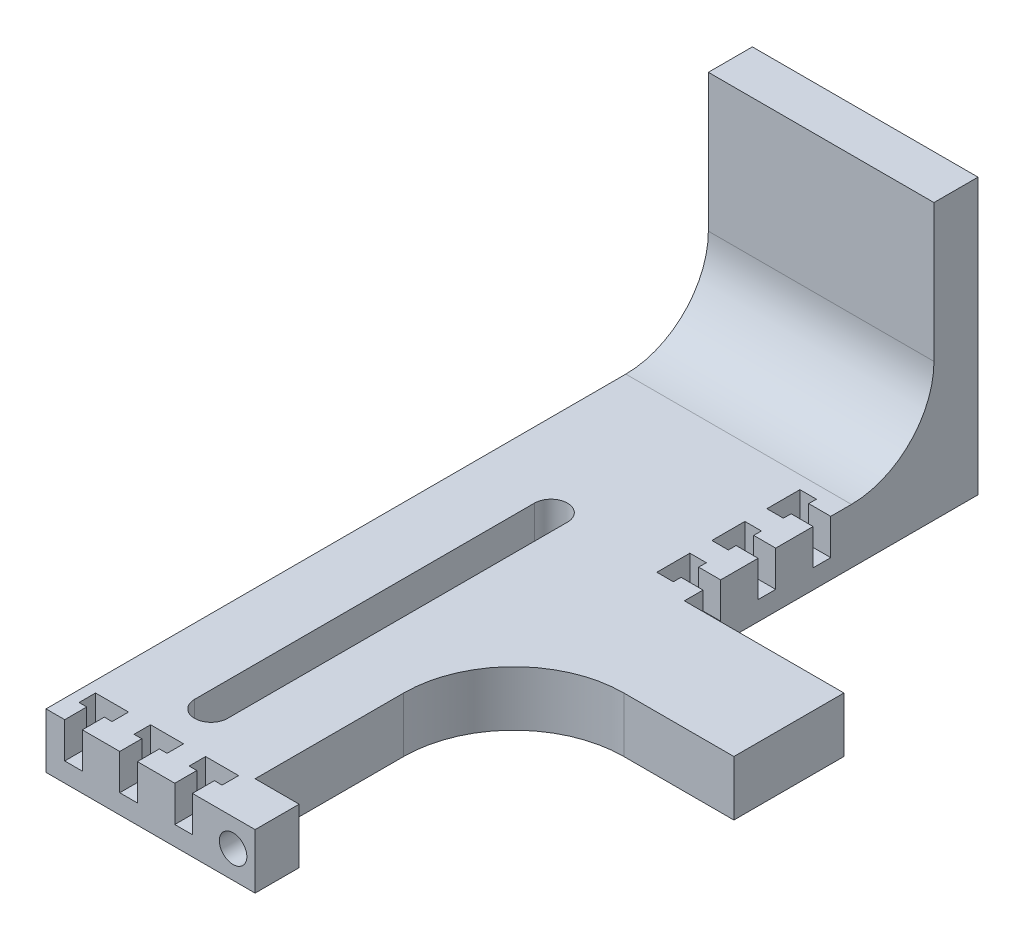
from build123d import *

# Parameters (mm, degrees)
EXTRUDE_1_DEPTH     = 10
CUT_EXTRUDE_3_DEPTH = 16
SKETCH_6_W          = 4
SKETCH_6_H          = 3.2
SKETCH_6_W_2        = 3.2
SKETCH_6_H_2        = 4
CUT_EXTRUDE_5_DEPTH = 6.5
SKETCH_7_W          = 6
SKETCH_7_H          = 3
SKETCH_7_W_2        = 3
SKETCH_7_H_2        = 6
CUT_EXTRUDE_6_DEPTH = 16.5
SKETCH_8_W          = 40
SKETCH_8_H          = 20
EXTRUDE_2_DEPTH     = 10
SKETCH_9_W          = 41
SKETCH_9_H          = 10
EXTRUDE_3_DEPTH     = 23.36
SKETCH_10_W         = 41
SKETCH_10_H         = 8
EXTRUDE_4_DEPTH     = 40
SKETCH_11_W         = 8
SKETCH_11_H         = 8
EXTRUDE_5_DEPTH     = 10
SKETCH_12_R         = 2.5
CUT_EXTRUDE_7_DEPTH = 10
FILLET_1_R          = 20
FILLET_2_R          = 15


with BuildPart() as part:
    # 草图1 → 凸台-拉伸1 (new body)
    with BuildSketch(Plane(origin=(0, 0, 0), x_dir=(1, 0, 0), z_dir=(0, 1, 0))):
        Polygon((0, 105), (0, 75), (0, 0), (30, 0), (30, 75), (41, 75), (41, 105), (30, 105), align=None)
    extrude(amount=EXTRUDE_1_DEPTH)

    # 草图4 → 切除-拉伸3 (cut)
    with BuildSketch(Plane(origin=(0, 10, 0), x_dir=(1, 0, 0), z_dir=(0, 1, 0))):
        with BuildLine():
            Line((12, 15), (12, 76.76156826))
            ThreePointArc((12, 76.76156826), (15, 79.76156826), (18, 76.76156826))
            Line((18, 76.76156826), (18, 15))
            ThreePointArc((18, 15), (15, 12), (12, 15))
        make_face()
    extrude(amount=-CUT_EXTRUDE_3_DEPTH, mode=Mode.SUBTRACT)

    # 草图6 → 切除-拉伸5 (cut)
    with BuildSketch(Plane(origin=(0, 10, 0), x_dir=(1, 0, 0), z_dir=(0, 1, 0))):
        with Locations((39, 100)):
            Rectangle(SKETCH_6_W, SKETCH_6_H)
        with Locations((5, 2)):
            Rectangle(SKETCH_6_W_2, SKETCH_6_H_2)
        with Locations((39, 90)):
            Rectangle(SKETCH_6_W, SKETCH_6_H)
        with Locations((39, 80)):
            Rectangle(SKETCH_6_W, SKETCH_6_H)
        with Locations((15, 2)):
            Rectangle(SKETCH_6_W_2, SKETCH_6_H_2)
        with Locations((25, 2)):
            Rectangle(SKETCH_6_W_2, SKETCH_6_H_2)
    extrude(amount=-CUT_EXTRUDE_5_DEPTH, mode=Mode.SUBTRACT)

    # 草图7 → 切除-拉伸6 (cut)
    with BuildSketch(Plane(origin=(0, 10, 0), x_dir=(1, 0, 0), z_dir=(0, 1, 0))):
        with Locations((5, 5.5)):
            Rectangle(SKETCH_7_W, SKETCH_7_H)
        with Locations((15, 5.5)):
            Rectangle(SKETCH_7_W, SKETCH_7_H)
        with Locations((25, 5.5)):
            Rectangle(SKETCH_7_W, SKETCH_7_H)
        with Locations((35.5, 100)):
            Rectangle(SKETCH_7_W_2, SKETCH_7_H_2)
        with Locations((35.5, 90)):
            Rectangle(SKETCH_7_W_2, SKETCH_7_H_2)
        with Locations((35.5, 80)):
            Rectangle(SKETCH_7_W_2, SKETCH_7_H_2)
    extrude(amount=-CUT_EXTRUDE_6_DEPTH, mode=Mode.SUBTRACT)

    # 草图8 → 凸台-拉伸2 (add)
    with BuildSketch(Plane.XZ):
        with Locations((50, -65)):
            Rectangle(SKETCH_8_W, SKETCH_8_H)
    extrude(amount=-EXTRUDE_2_DEPTH)

    # 草图9 → 凸台-拉伸3 (add)
    with BuildSketch(Plane(origin=(0, 0, -105), x_dir=(-1, 0, 0), z_dir=(0, 0, -1))):
        with Locations((-20.5, 5)):
            Rectangle(SKETCH_9_W, SKETCH_9_H)
    extrude(amount=EXTRUDE_3_DEPTH)

    # 草图10 → 凸台-拉伸4 (add)
    with BuildSketch(Plane(origin=(0, 10, 0), x_dir=(1, 0, 0), z_dir=(0, 1, 0))):
        with Locations((20.5, 124.36)):
            Rectangle(SKETCH_10_W, SKETCH_10_H)
    extrude(amount=EXTRUDE_4_DEPTH)

    # 草图11 → 凸台-拉伸5 (add)
    with BuildSketch(Plane.XZ):
        with Locations((34, -4)):
            Rectangle(SKETCH_11_W, SKETCH_11_H)
    extrude(amount=-EXTRUDE_5_DEPTH)

    # 草图12 → 切除-拉伸7 (cut)
    with BuildSketch(Plane(origin=(0, 0, -8), x_dir=(-1, 0, 0), z_dir=(0, 0, -1))):
        with Locations((-34, 5)):
            Circle(SKETCH_12_R)
    extrude(amount=-CUT_EXTRUDE_7_DEPTH, mode=Mode.SUBTRACT)

    # 圆角1
    fillet_1_edges = [part.edges().sort_by_distance(p)[0] for p in [
        (30, 5, -55),
    ]]
    fillet(fillet_1_edges, radius=FILLET_1_R)

    # 圆角2
    fillet_2_edges = [part.edges().sort_by_distance(p)[0] for p in [
        (20.5, 10, -120.36),
    ]]
    fillet(fillet_2_edges, radius=FILLET_2_R)


solid = part.part
